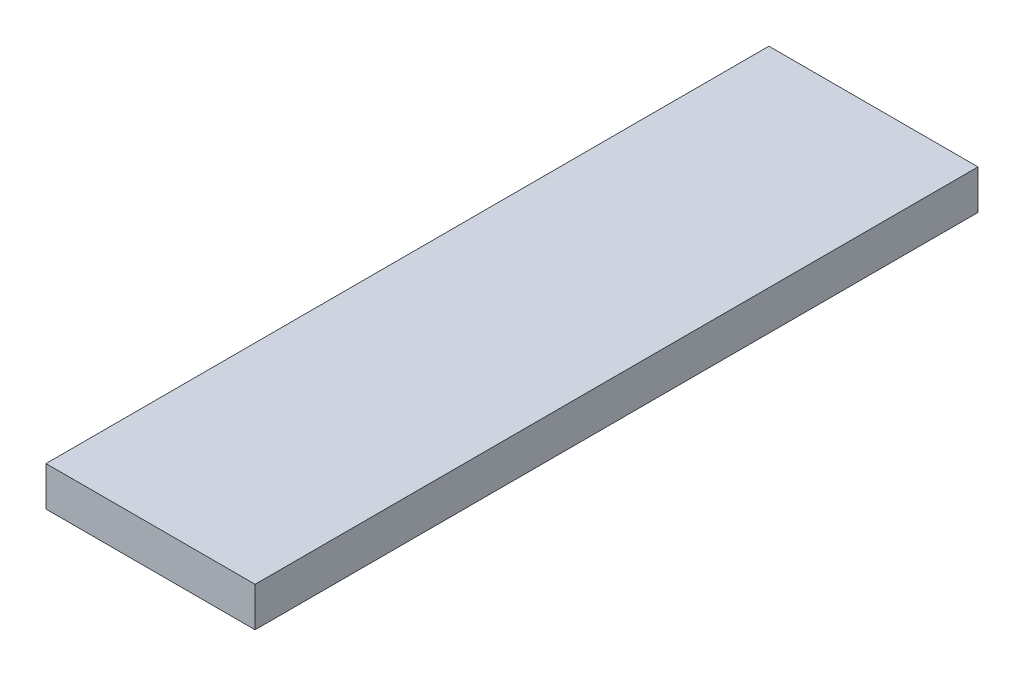
from build123d import *

# Parameters (mm, degrees)
SKETCH2_W           = 24.384
SKETCH2_H           = 84.300000056
BOSS_EXTRUDE1_DEPTH = 4.599999944


with BuildPart() as part:
    # Sketch2 → Boss-Extrude1 (new body)
    with BuildSketch(Plane(origin=(0, 0, 0), x_dir=(1, 0, 0), z_dir=(0, 1, 0))):
        with Locations((12.192, 42.150000028)):
            Rectangle(SKETCH2_W, SKETCH2_H)
    extrude(amount=BOSS_EXTRUDE1_DEPTH)


solid = part.part
